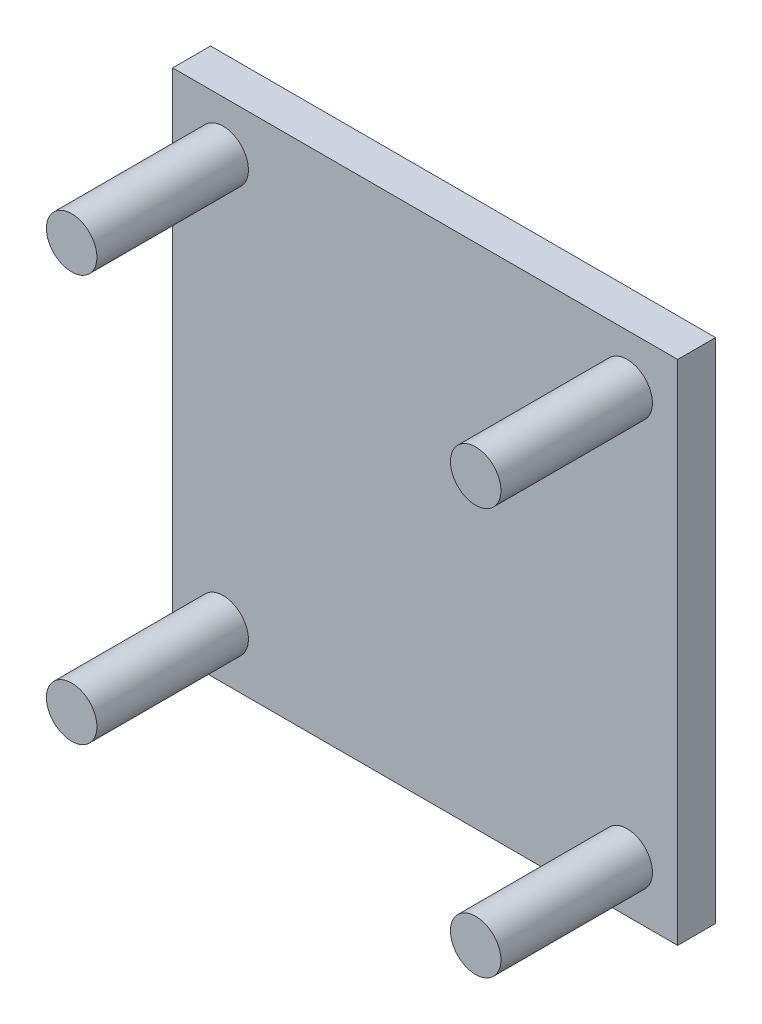
from build123d import *

# Parameters (mm, degrees)
SKETCH_1_W         = 40
SKETCH_1_H         = 40.193398756
FORMER_BASE_DEPTH  = 3
FORMER_POSTS_START = 3
SKETCH_2_R         = 2
FORMER_POSTS_DEPTH = 12


with BuildPart() as part:
    # Эскиз1 → Former_base (new body)
    with BuildSketch(Plane.XY):
        Rectangle(SKETCH_1_W, SKETCH_1_H)
    extrude(amount=FORMER_BASE_DEPTH)

    # Эскиз2 → Former_posts (add)
    with BuildSketch(Plane.XY.offset(FORMER_POSTS_START)):
        with Locations((-16, -16.096699378)):
            Circle(SKETCH_2_R)
        with Locations((-16, 16.096699378)):
            Circle(SKETCH_2_R)
        with Locations((16, -16.096699378)):
            Circle(SKETCH_2_R)
        with Locations((16, 16.096699378)):
            Circle(SKETCH_2_R)
    extrude(amount=FORMER_POSTS_DEPTH)


solid = part.part
